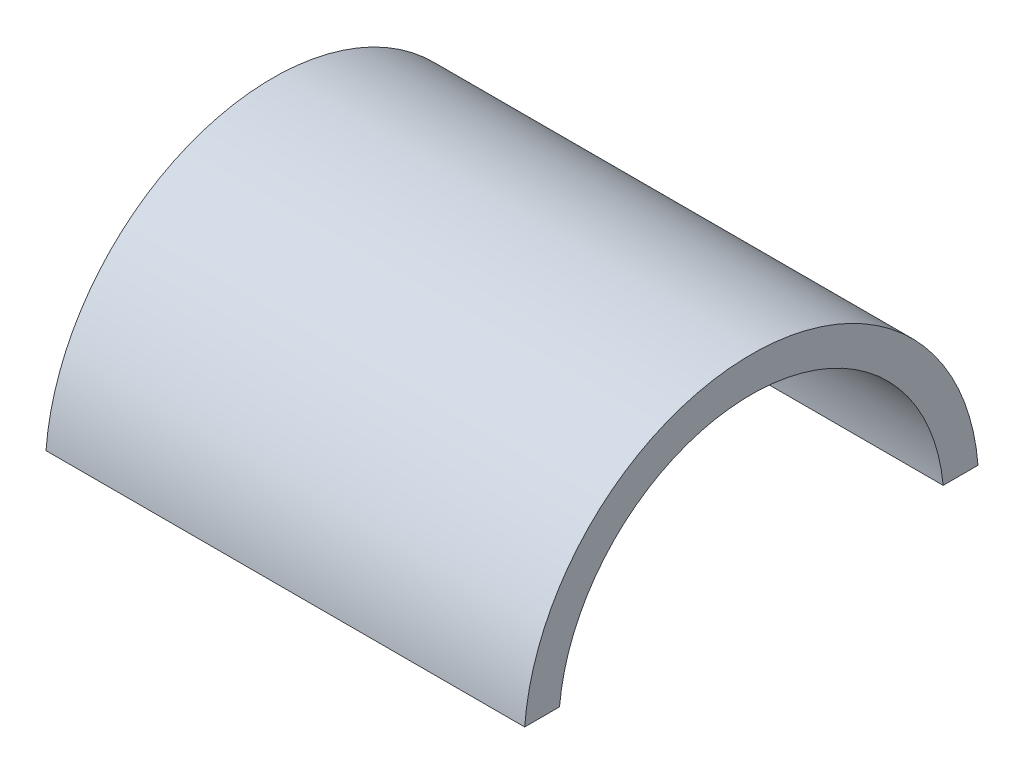
from build123d import *

# Parameters (mm, degrees)
BOSS_EXTRUDE1_DEPTH = 25.4


with BuildPart() as part:
    # Sketch1 → Boss-Extrude1 (new, symmetric)
    with BuildSketch(Plane(origin=(0, 0, 0), x_dir=(0, 0, -1), z_dir=(1, 0, 0))):
        with BuildLine():
            Line((-24.054685095, 1.905), (-20.358064348, 1.905))
            ThreePointArc((-20.358064348, 1.905), (0, 20.447), (20.358064348, 1.905))
            Line((20.358064348, 1.905), (24.054685095, 1.905))
            ThreePointArc((24.054685095, 1.905), (0, 24.13), (-24.054685095, 1.905))
        make_face()
    extrude(amount=BOSS_EXTRUDE1_DEPTH, both=True)


solid = part.part
